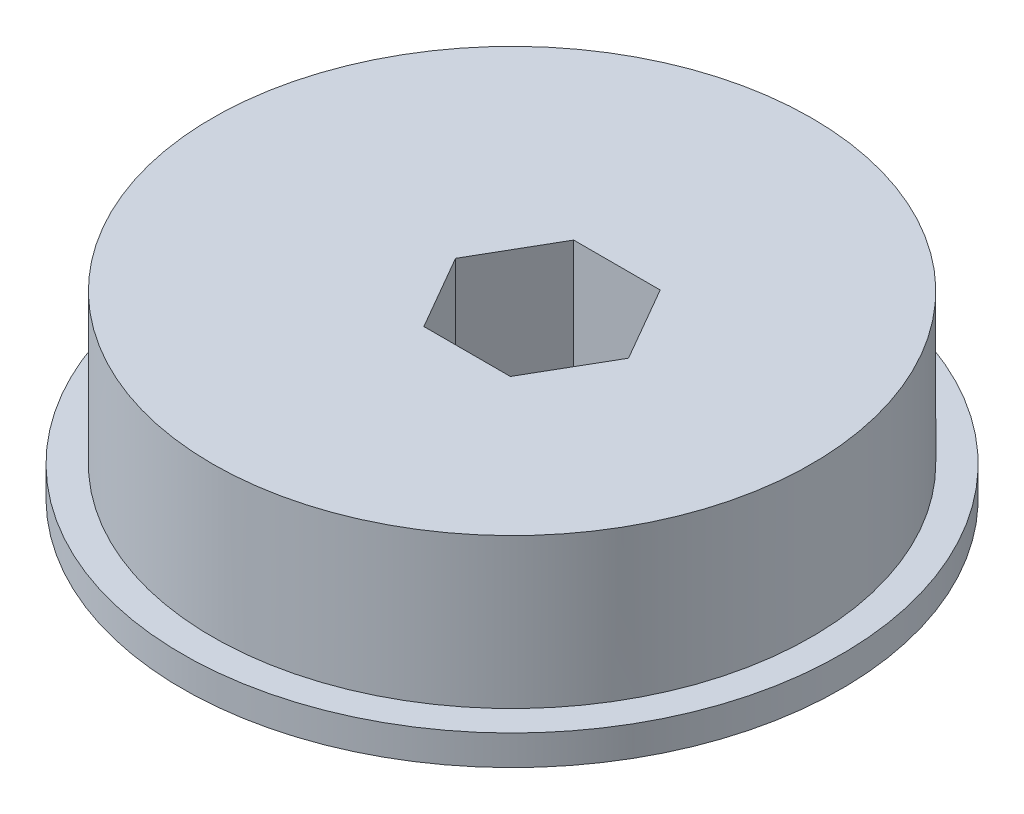
from build123d import *

# Parameters (mm, degrees)
SKETCH1_R           = 10
BOSS_EXTRUDE1_DEPTH = 6
SKETCH2_R           = 11
BOSS_EXTRUDE2_DEPTH = 1
CUT_EXTRUDE1_DEPTH  = 18.349351573


with BuildPart() as part:
    # Sketch1 → Boss-Extrude1 (new body)
    with BuildSketch(Plane(origin=(0, 0, 0), x_dir=(1, 0, 0), z_dir=(0, 1, 0))):
        with Locations(Location((-1, 0, 0), (0, 0, 270))):
            Circle(SKETCH1_R)
    extrude(amount=BOSS_EXTRUDE1_DEPTH)

    # Sketch2 → Boss-Extrude2 (add)
    with BuildSketch(Plane.XZ):
        with Locations(Location((-1, 0, 0), (0, 0, 270))):
            Circle(SKETCH2_R)
    extrude(amount=-BOSS_EXTRUDE2_DEPTH)

    # Sketch4 → Cut-Extrude1 (cut, through all)
    with BuildSketch(Plane(origin=(0, 6, 0), x_dir=(1, 0, 0), z_dir=(0, 1, 0))):
        Polygon((2.886751346, 0), (1.443375673, 2.5), (-1.443375673, 2.5), (-2.886751346, 0), (-1.443375673, -2.5), (1.443375673, -2.5), align=None)
    extrude(amount=-CUT_EXTRUDE1_DEPTH, mode=Mode.SUBTRACT)


solid = part.part
